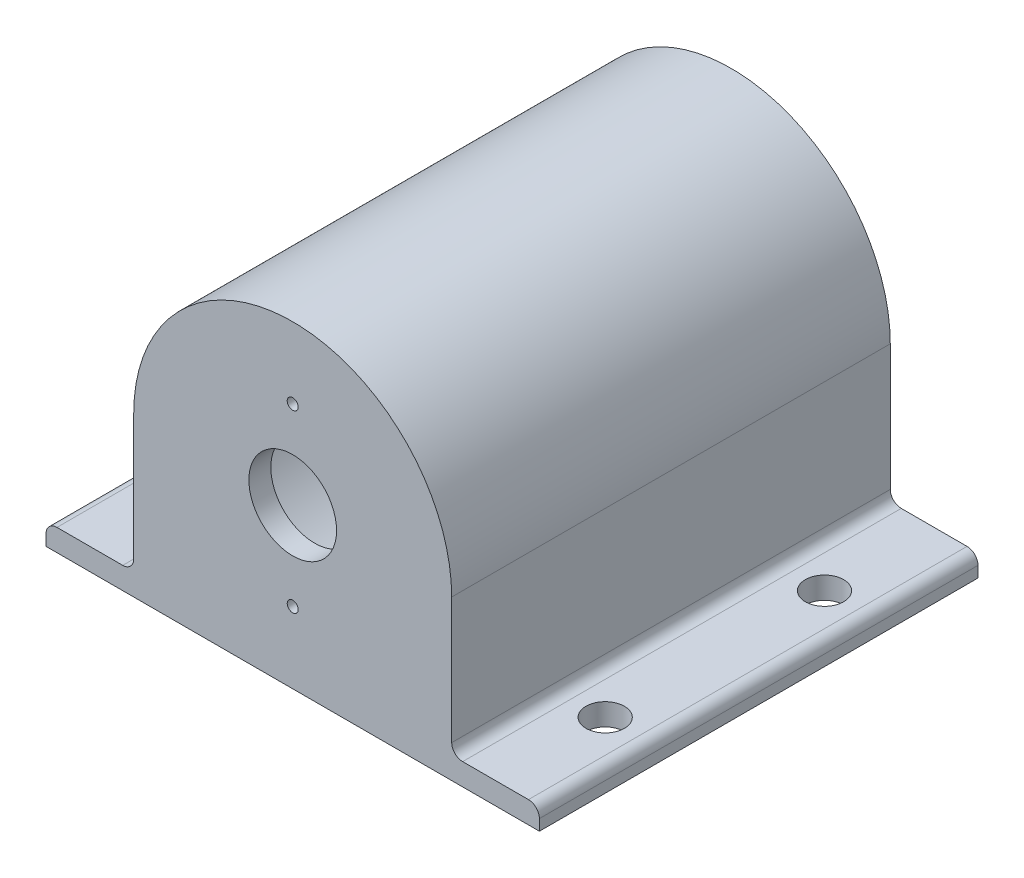
from build123d import *
from build123d.topology import SkipClean

# Parameters (mm, degrees)
BOSS_EXTRU_1_DEPTH      = 40
ESQUISSE2_W             = 2
ESQUISSE2_H             = 40
BOSS_EXTRU_2_DEPTH      = 12.5
BOSS_EXTRU_4_START      = -2
ESQUISSE4_R             = 4
BOSS_EXTRU_4_DEPTH      = 2
ESQUISSE5_R             = 0.5
ENL_V_MAT_EXTRU_1_DEPTH = 45.949972191
BOSS_EXTRU_13_DEPTH     = 40
BOSS_EXTRU_14_START     = 38
BOSS_EXTRU_14_DEPTH     = 38
CONG_1_R                = 1
ESQUISSE10_R            = 1.75
ENL_V_MAT_EXTRU_2_DEPTH = 54.247065647


with BuildPart() as part:
    # Esquisse1 → Boss.-Extru.1 (new body)
    with BuildSketch(Plane.XY):
        with BuildLine():
            ThreePointArc((-12.5, 0), (0, 12.5), (12.5, 0))
            Line((12.5, 0), (14.5, 0))
            ThreePointArc((14.5, 0), (0, 14.5), (-14.5, 0))
            Line((-14.5, 0), (-12.5, 0))
        make_face()
    extrude(amount=BOSS_EXTRU_1_DEPTH)

    # Esquisse2 → Boss.-Extru.2 (add)
    with BuildSketch(Plane.XZ):
        with Locations((-13.5, 20)):
            Rectangle(ESQUISSE2_W, ESQUISSE2_H)
        with Locations((13.5, 20)):
            Rectangle(ESQUISSE2_W, ESQUISSE2_H)
    extrude(amount=BOSS_EXTRU_2_DEPTH)

    # Esquisse4 → Boss.-Extru.4 (add)
    with BuildSketch(Plane.XY.offset(40).offset(BOSS_EXTRU_4_START)):
        with BuildLine():
            Line((-12.5, 0), (-12.5, -12.5))
            Line((-12.5, -12.5), (12.5, -12.5))
            Line((12.5, -12.5), (12.5, 0))
            ThreePointArc((12.5, 0), (0, 12.5), (-12.5, 0))
        make_face()
        Circle(ESQUISSE4_R, mode=Mode.SUBTRACT)
    extrude(amount=BOSS_EXTRU_4_DEPTH)

    # Esquisse5 → Enlèv. mat.-Extru.1 (cut, through all)
    with BuildSketch(Plane.XY.offset(40)):
        with Locations((0, -8)):
            Circle(ESQUISSE5_R)
        with Locations((0, 8)):
            Circle(ESQUISSE5_R)
    extrude(amount=-ENL_V_MAT_EXTRU_1_DEPTH, mode=Mode.SUBTRACT)

    # Esquisse8 → Boss.-Extru.13 (add)
    with BuildSketch(Plane.XY.offset(40)):
        Polygon((-14.5, -12.5), (-22.5, -12.5), (-22.5, -14.5), (22.5, -14.5), (22.5, -12.5), (14.5, -12.5), align=None)
    extrude(amount=-BOSS_EXTRU_13_DEPTH)

    # Esquisse9 → Boss.-Extru.14 (add)
    with SkipClean():  # the faces are left unmerged after this step: merging them gives an invalid solid
        with BuildSketch(Plane(origin=(0, 0, 38), x_dir=(-1, 0, 0), z_dir=(0, 0, -1)).offset(BOSS_EXTRU_14_START)):
            with BuildLine():
                Line((-12.5, 0), (-12.5, -12.5))
                Line((-12.5, -12.5), (-3e-08, -12.5))
                ThreePointArc((-3e-08, -12.5), (-8.838834775, -8.838834754), (-12.5, 0))
            make_face()
            with BuildLine():
                ThreePointArc((12.5, 0), (8.838834754, -8.838834775), (-3e-08, -12.5))
                Line((-3e-08, -12.5), (12.5, -12.5))
                Line((12.5, -12.5), (12.5, 0))
            make_face()
        extrude(amount=-BOSS_EXTRU_14_DEPTH)

    # Congé1
    cong_1_edges = [part.edges().sort_by_distance(p)[0] for p in [
        (-14.5, -12.5, 20),
        (14.5, -12.5, 20),
        (-22.5, -12.5, 20),
        (22.5, -12.5, 20),
    ]]
    fillet(cong_1_edges, radius=CONG_1_R)

    # Esquisse10 → Enlèv. mat.-Extru.2 (cut, through all)
    with SkipClean():  # the faces are left unmerged after this step: merging them gives an invalid solid
        with BuildSketch(Plane(origin=(0, -12.5, 0), x_dir=(1, 0, 0), z_dir=(0, 1, 0))):
            with Locations(Location((-18.5, -10, 0), (0, 0, 180))):
                Circle(ESQUISSE10_R)
            with Locations(Location((-18.5, -30, 0), (0, 0, 180))):
                Circle(ESQUISSE10_R)
            with Locations(Location((18.5, -30, 0), (0, 0, 180))):
                Circle(ESQUISSE10_R)
            with Locations(Location((18.5, -10, 0), (0, 0, 180))):
                Circle(ESQUISSE10_R)
        extrude(amount=-ENL_V_MAT_EXTRU_2_DEPTH, mode=Mode.SUBTRACT)


solid = part.part
